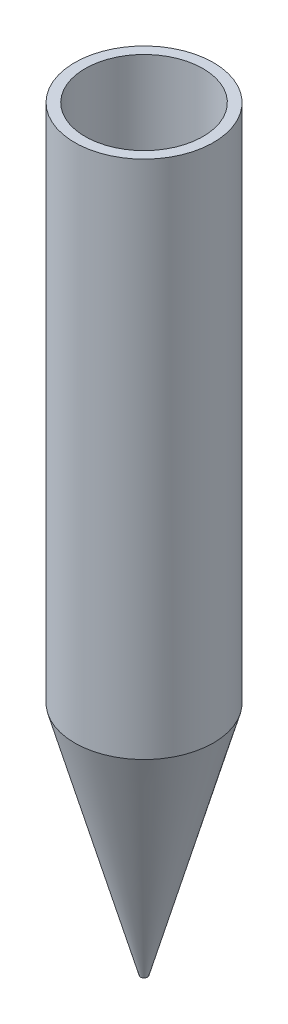
from build123d import *


with BuildPart() as part:
    # Sketch3 → Revolve1 (revolve)
    with BuildSketch(Plane.XY, mode=Mode.PRIVATE) as revolve1_sk:
        Polygon((0, 0), (1, 0), (20, 68), (20, 218), (17, 218), (17, 68), (0, 68), align=None)
    revolve(revolve1_sk.sketch.rotate(Axis((0, 0, 0), (0, 1, 0)), 90), axis=Axis((0, 0, 0), (0, 1, 0)))


solid = part.part
